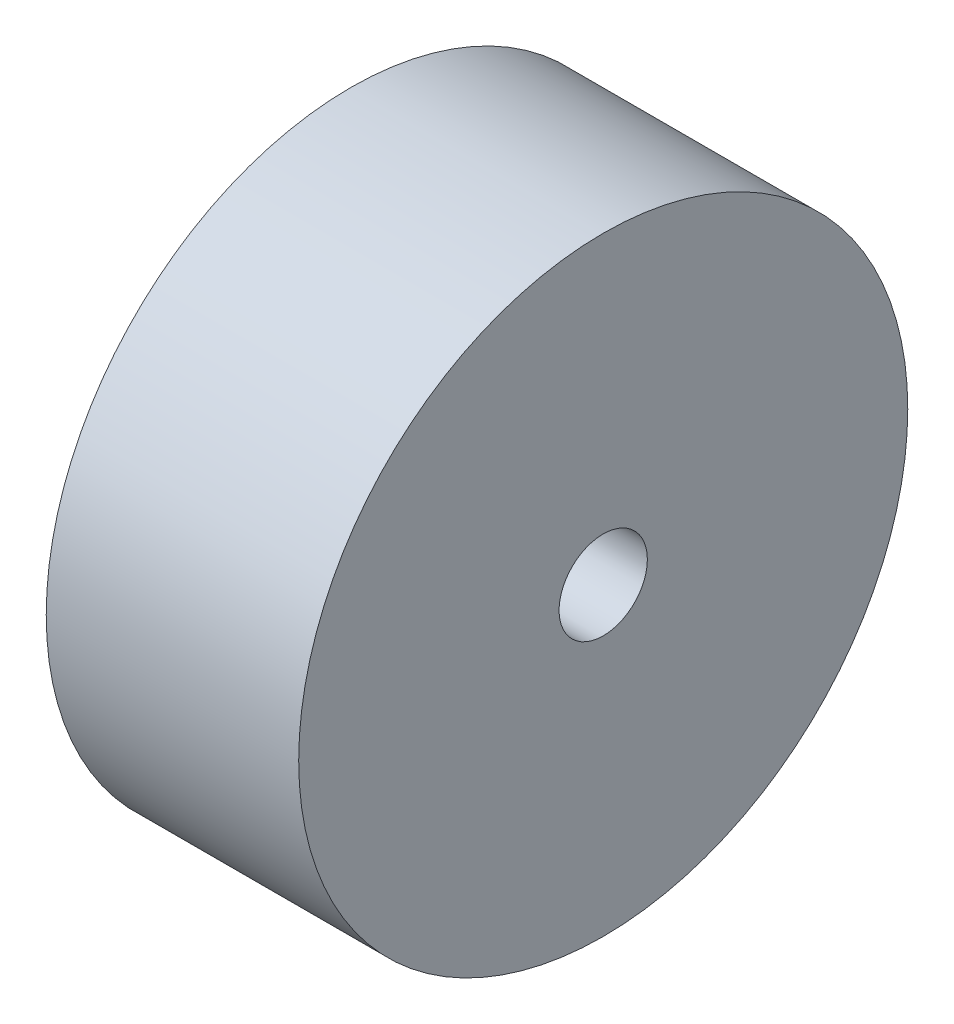
from build123d import *

# Parameters (mm, degrees)
SKETCH1_R               = 17.25
BOSS_EXTRUDE1_DEPTH     = 14.3
CUT_EXTRUDE1_DEPTH      = 29.277464526
CUT_EXTRUDE1_DEPTH_BACK = 29.277464526
SKETCH2_R               = 2.5


with BuildPart() as part:
    # Sketch1 → Boss-Extrude1 (new body)
    with BuildSketch(Plane(origin=(0, 0, 0), x_dir=(0, 0, -1), z_dir=(1, 0, 0))):
        Circle(SKETCH1_R)
    extrude(amount=BOSS_EXTRUDE1_DEPTH)

    # Sketch2 → Cut-Extrude1 (cut, two sides: drawn at the far end of the back side and taken through both)
    with BuildSketch(Plane(origin=(14.3, 0, 0), x_dir=(0, 0, -1), z_dir=(1, 0, 0)).offset(-CUT_EXTRUDE1_DEPTH_BACK)):
        Circle(SKETCH2_R)
    extrude(amount=CUT_EXTRUDE1_DEPTH + CUT_EXTRUDE1_DEPTH_BACK, mode=Mode.SUBTRACT)


solid = part.part
